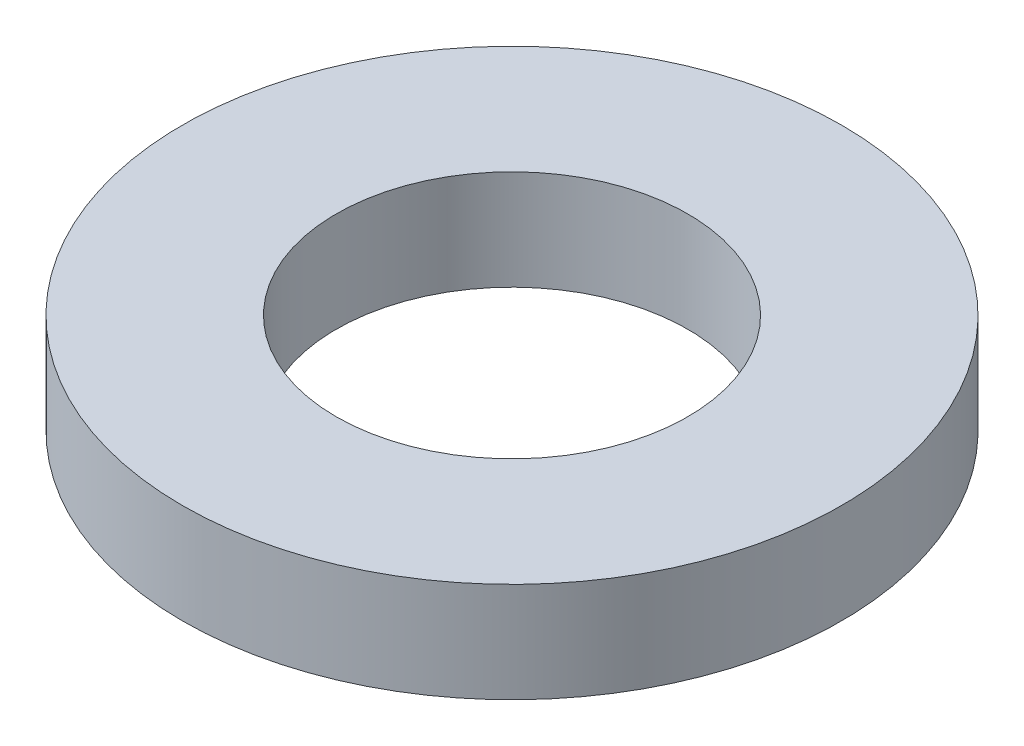
from build123d import *

# Parameters (mm, degrees)
SKETCH1_R           = 11.90625
SKETCH1_R_2         = 6.35
BOSS_EXTRUDE1_DEPTH = 3.609975


with BuildPart() as part:
    # Sketch1 → Boss-Extrude1 (new body)
    with BuildSketch(Plane(origin=(0, 0, 0), x_dir=(1, 0, 0), z_dir=(0, 1, 0))):
        with Locations(Location((0, 0, 0), (0, 0, 270))):
            Circle(SKETCH1_R)
        with Locations(Location((0, 0, 0), (0, 0, 270))):
            Circle(SKETCH1_R_2, mode=Mode.SUBTRACT)
    extrude(amount=BOSS_EXTRUDE1_DEPTH)


solid = part.part
